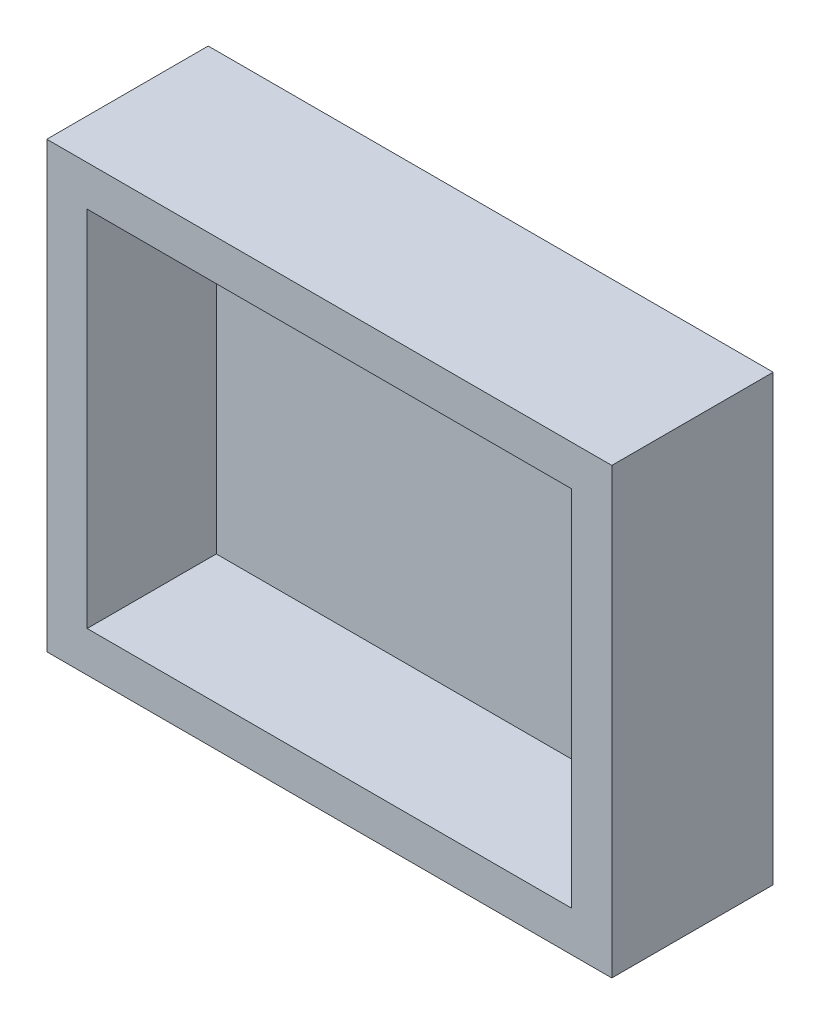
from build123d import *

# Parameters (mm, degrees)
SKETCH1_W           = 70
SKETCH1_H           = 55
SKETCH1_W_2         = 60
SKETCH1_H_2         = 45
BOSS_EXTRUDE1_DEPTH = 20
SKETCH2_W           = 60
SKETCH2_H           = 45
BOSS_EXTRUDE2_DEPTH = 4


with BuildPart() as part:
    # Sketch1 → Boss-Extrude1 (new body)
    with BuildSketch(Plane.XY):
        with Locations((-7.298895247, -16.371962617)):
            Rectangle(SKETCH1_W, SKETCH1_H)
        with Locations((-7.298895247, -16.371962617)):
            Rectangle(SKETCH1_W_2, SKETCH1_H_2, mode=Mode.SUBTRACT)
    extrude(amount=BOSS_EXTRUDE1_DEPTH)

    # Sketch2 → Boss-Extrude2 (add)
    with BuildSketch(Plane.XY):
        with Locations((-7.298895247, -16.371962617)):
            Rectangle(SKETCH2_W, SKETCH2_H)
    extrude(amount=BOSS_EXTRUDE2_DEPTH)


solid = part.part
